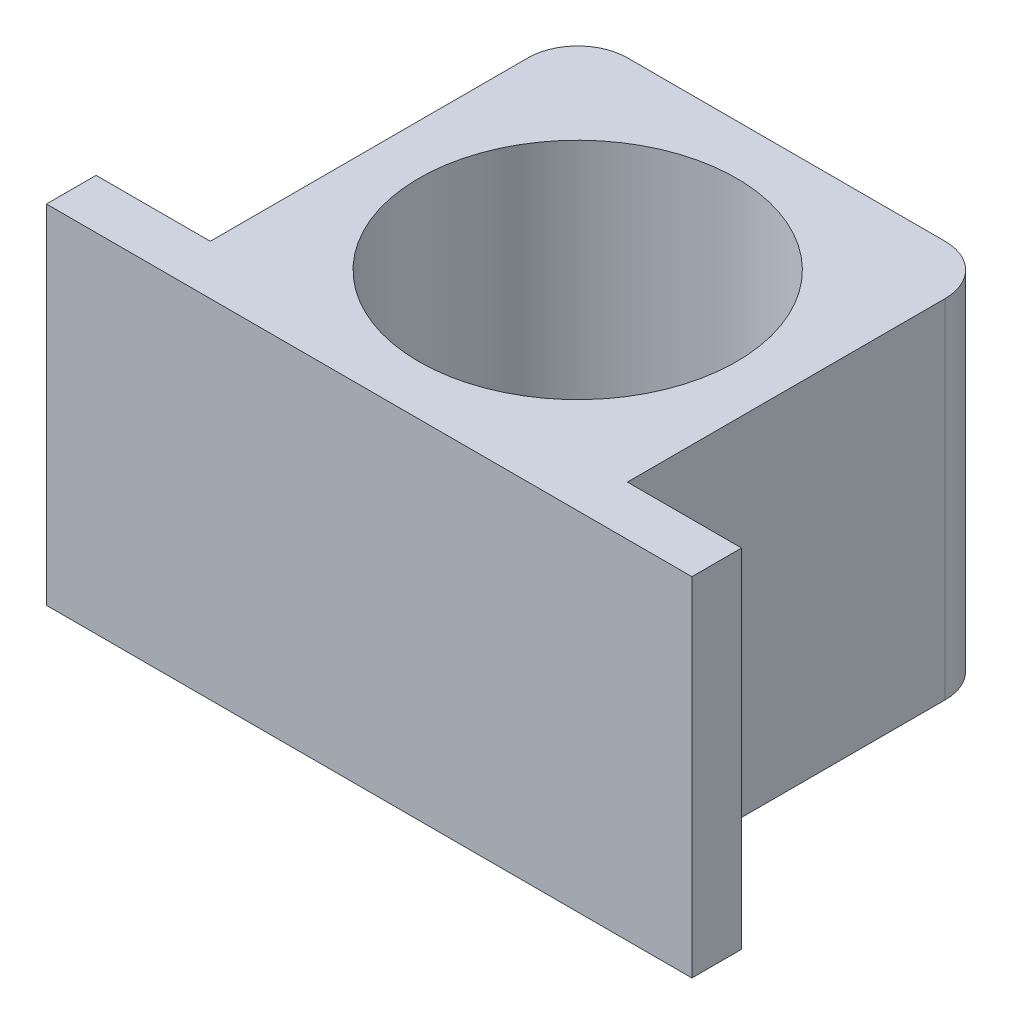
from build123d import *

# Parameters (mm, degrees)
SKETCH3_W           = 55
SKETCH3_H           = 42
BOSS_EXTRUDE1_DEPTH = 35
SKETCH4_R           = 16
CUT_EXTRUDE1_DEPTH  = 35
SKETCH5_W           = 6.5
SKETCH5_H           = 37
CUT_EXTRUDE2_DEPTH  = 35
FILLET1_R           = 5
SKETCH6_W           = 5
SKETCH6_H           = 35
BOSS_EXTRUDE2_DEPTH = 5
SKETCH7_W           = 5
SKETCH7_H           = 35
BOSS_EXTRUDE3_DEPTH = 5


with BuildPart() as part:
    # Sketch3 → Boss-Extrude1 (new body)
    with BuildSketch(Plane(origin=(0, 0, 0), x_dir=(1, 0, 0), z_dir=(0, 1, 0))):
        Rectangle(SKETCH3_W, SKETCH3_H)
    extrude(amount=BOSS_EXTRUDE1_DEPTH)

    # Sketch4 → Cut-Extrude1 (cut)
    with BuildSketch(Plane(origin=(0, 35, 0), x_dir=(1, 0, 0), z_dir=(0, 1, 0))):
        with Locations(Location((0, 0, 0), (0, 0, 270))):
            Circle(SKETCH4_R)
    extrude(amount=-CUT_EXTRUDE1_DEPTH, mode=Mode.SUBTRACT)

    # Sketch5 → Cut-Extrude2 (cut)
    with BuildSketch(Plane(origin=(0, 35, 0), x_dir=(1, 0, 0), z_dir=(0, 1, 0))):
        with Locations((-24.25, 2.5)):
            Rectangle(SKETCH5_W, SKETCH5_H)
        with Locations((24.25, 2.5)):
            Rectangle(SKETCH5_W, SKETCH5_H)
    extrude(amount=-CUT_EXTRUDE2_DEPTH, mode=Mode.SUBTRACT)

    # Fillet1
    fillet1_edges = [part.edges().sort_by_distance(p)[0] for p in [
        (-21, 17.5, -21),
        (21, 17.5, -21),
    ]]
    fillet(fillet1_edges, radius=FILLET1_R)

    # Sketch6 → Boss-Extrude2 (add)
    with BuildSketch(Plane(origin=(27.5, 0, 0), x_dir=(0, 0, -1), z_dir=(1, 0, 0))):
        with Locations((-18.5, 17.5)):
            Rectangle(SKETCH6_W, SKETCH6_H)
    extrude(amount=BOSS_EXTRUDE2_DEPTH)

    # Sketch7 → Boss-Extrude3 (add)
    with BuildSketch(Plane.ZY.offset(27.5)):
        with Locations((18.5, 17.5)):
            Rectangle(SKETCH7_W, SKETCH7_H)
    extrude(amount=BOSS_EXTRUDE3_DEPTH)


solid = part.part
